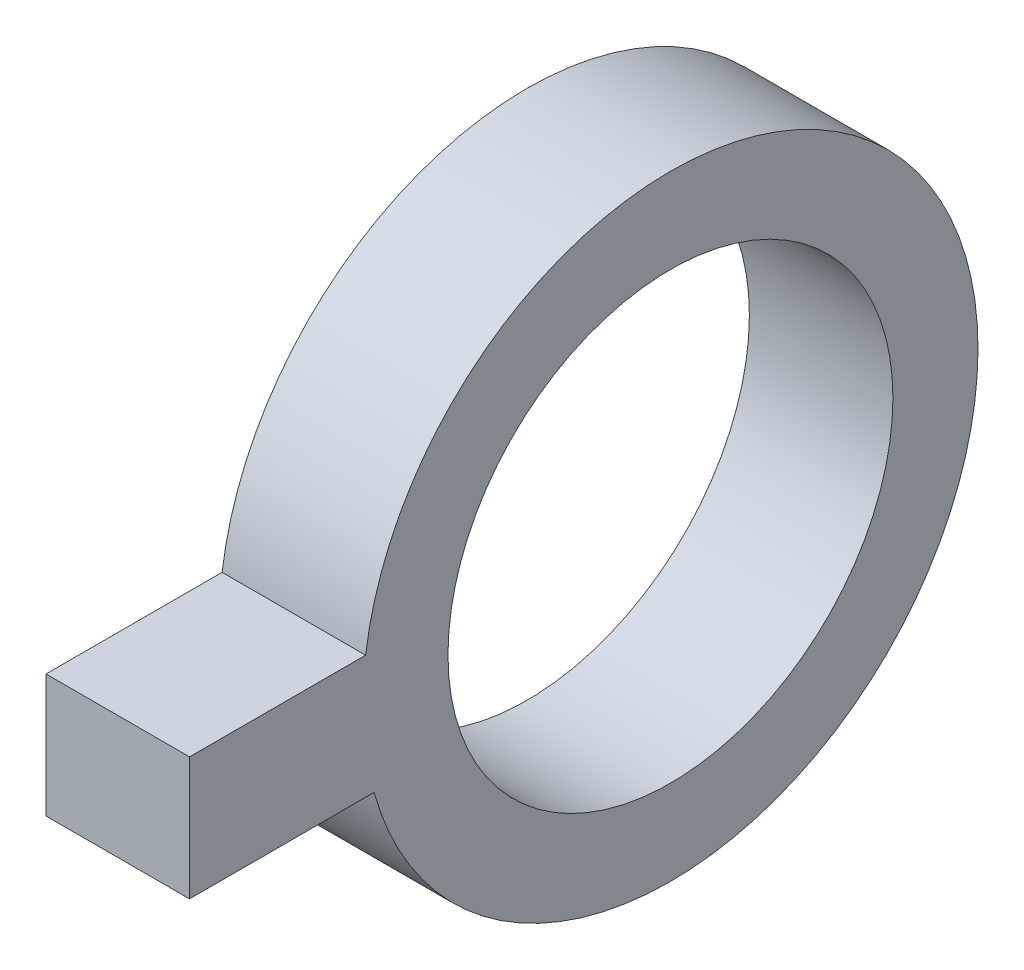
from build123d import *

# Parameters (mm, degrees)
BOSS_EXTRUDE1_DEPTH      = 6
SKETCH2_R                = 5
CUT_EXTRUDE1_DEPTH       = 107
BOSS_EXTRUDE2_DEPTH      = 3.5
BOSS_EXTRUDE2_DEPTH_BACK = 3.5
SKETCH3_R                = 15
SKETCH4_R                = 10.85
CUT_EXTRUDE2_DEPTH       = 19.5
CIRPATTERN1_COUNT        = 3
SKETCH6_R                = 5
BOSS_EXTRUDE3_DEPTH      = 34
CUT_EXTRUDE5_DEPTH       = 103.68939394
CUT_EXTRUDE5_DEPTH_BACK  = 103.68939394
SKETCH12_W               = 81.781179221
SKETCH12_H               = 82.49231991
CUT_EXTRUDE6_DEPTH       = 39.848263365
CUT_EXTRUDE6_DEPTH_BACK  = 39.848263365
SKETCH13_W               = 17.873677222
SKETCH13_H               = 13.388121455
SKETCH13_W_2             = 15.899401816
SKETCH13_H_2             = 11.800117324


with BuildPart() as part:
    # Sketch1 → Boss-Extrude1 (new body)
    with BuildSketch(Plane(origin=(0, 0, 0), x_dir=(1, 0, 0), z_dir=(0, 1, 0))):
        Polygon((-11.547005384, 40), (-40.414518843, -10), (-28.867513459, -30), (28.867513459, -30), (40.414518843, -10), (11.547005384, 40), align=None)
    extrude(amount=BOSS_EXTRUDE1_DEPTH)

    # Sketch2 → Cut-Extrude1 (cut)
    with BuildSketch(Plane(origin=(0, 6, 0), x_dir=(1, 0, 0), z_dir=(0, 1, 0))):
        Circle(SKETCH2_R)
    extrude(amount=-CUT_EXTRUDE1_DEPTH, mode=Mode.SUBTRACT)

    # Sketch3 → Boss-Extrude2 (add, two sides: drawn at the far end of the back side and taken through both)
    with BuildSketch(Plane(origin=(0, 0, 0), x_dir=(0, 0, -1), z_dir=(1, 0, 0)).offset(-BOSS_EXTRUDE2_DEPTH_BACK)):
        with Locations((54.454926612, 4.00688116)):
            Circle(SKETCH3_R)
    extrude(amount=BOSS_EXTRUDE2_DEPTH + BOSS_EXTRUDE2_DEPTH_BACK)

    # Sketch4 → Cut-Extrude2 (cut)
    with BuildSketch(Plane(origin=(3.5, 0, 0), x_dir=(0, 0, -1), z_dir=(1, 0, 0))):
        with Locations((54.454926612, 4.00688116)):
            Circle(SKETCH4_R)
    extrude(amount=-CUT_EXTRUDE2_DEPTH, mode=Mode.SUBTRACT)


with BuildPart() as cirpattern1_1:
    # CirPattern1: pattern copy
    add(part.part.rotate(Axis((0, -101, 0), (0, 1, 0)), 1 * 360 / CIRPATTERN1_COUNT))


with BuildPart() as cirpattern1_2:
    # CirPattern1: pattern copy
    add(part.part.rotate(Axis((0, -101, 0), (0, 1, 0)), 2 * 360 / CIRPATTERN1_COUNT))


with BuildPart() as part_1:
    add(part.part)

    add(cirpattern1_1.part)  # Boss-Extrude3 merges CirPattern1_1

    add(cirpattern1_2.part)  # Boss-Extrude3 merges CirPattern1_2
    # Sketch6 → Boss-Extrude3 (add)
    with BuildSketch(Plane(origin=(0, 6, 0), x_dir=(1, 0, 0), z_dir=(0, 1, 0))):
        Circle(SKETCH6_R)
    extrude(amount=-BOSS_EXTRUDE3_DEPTH)


with BuildPart() as body_2:
    # Sketch8 → Revolve1 (revolve)
    with BuildSketch(Plane(origin=(0, -28, 0), x_dir=(-1, 0, 0), z_dir=(0, -1, 0))):
        with BuildLine():
            Line((0, 10), (0, -10))
            ThreePointArc((0, -10), (10, 0), (0, 10))
        make_face()
    revolve(axis=Axis((0, -28, 0), (0, 0, -1)))


with BuildPart() as cut_extrude5_tool:
    # Sketch12 → Cut-Extrude5 (new, two sides: drawn at the far end of the back side and taken through both)
    with BuildSketch(Plane(origin=(3.5, 0, 0), x_dir=(0, 0, -1), z_dir=(1, 0, 0)).offset(-CUT_EXTRUDE5_DEPTH_BACK)):
        with Locations((-9.89058961, -10.029914937)):
            Rectangle(SKETCH12_W, SKETCH12_H)
    extrude(amount=CUT_EXTRUDE5_DEPTH + CUT_EXTRUDE5_DEPTH_BACK)


with BuildPart() as part_2:
    add(part_1.part)

    # Cut-Extrude5: cut by cut_extrude5_tool
    add(cut_extrude5_tool.part, mode=Mode.SUBTRACT)

    # Sketch13 → Cut-Extrude6 (cut, two sides: drawn at the far end of the back side and taken through both)
    with BuildSketch(Plane(origin=(0, 0, -40), x_dir=(-1, 0, 0), z_dir=(0, 0, -1)).offset(-CUT_EXTRUDE6_DEPTH_BACK)):
        with Locations((12.436838611, -0.694060728)):
            Rectangle(SKETCH13_W, SKETCH13_H)
        with Locations((-11.449700908, 0.099941338)):
            Rectangle(SKETCH13_W_2, SKETCH13_H_2)
    extrude(amount=CUT_EXTRUDE6_DEPTH + CUT_EXTRUDE6_DEPTH_BACK, mode=Mode.SUBTRACT)


with BuildPart() as body_2_1:
    add(body_2.part)

    # Cut-Extrude5: cut by cut_extrude5_tool
    add(cut_extrude5_tool.part, mode=Mode.SUBTRACT)


solid = part_2.part
